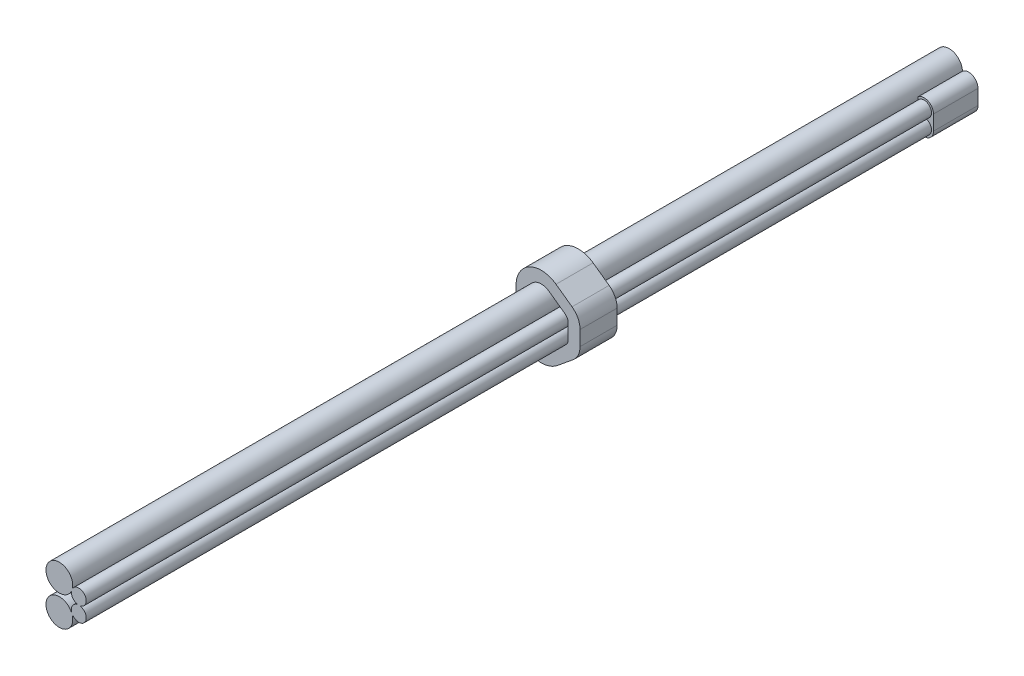
from build123d import *
from build123d.topology import SkipClean

# Parameters (mm, degrees)
BOSS_EXTRUDE1_DEPTH = 2.5
BOSS_EXTRUDE2_DEPTH = 22
BOSS_EXTRUDE3_DEPTH = 3
CUT_EXTRUDE1_DEPTH  = 24.5
BOSS_EXTRUDE4_START = 32.5
BOSS_EXTRUDE4_DEPTH = 32.5
FILLET1_R           = 1.3


with BuildPart() as part:
    # Sketch1 → Boss-Extrude1 (new body)
    with BuildSketch(Plane.XY.offset(27.5)):
        with BuildLine():
            Line((-1.7, 0), (-1.7, -2.01))
            ThreePointArc((-1.7, -2.01), (-0.728058535, -3.546206617), (1.076389141, -3.325821575))
            Line((1.076389141, -3.325821575), (2.613987517, -2.068011074))
            Line((2.613987517, -2.068011074), (2.613987517, 0.214645493))
            Line((2.613987517, 0.214645493), (0.99224156, 1.380382804))
            ThreePointArc((0.99224156, 1.380382804), (-0.775625344, 1.512747608), (-1.7, 0))
        make_face()
        with BuildLine():
            Line((0.679355547, -0.590318593), (0.679355547, -1.419681407))
            ThreePointArc((0.679355547, -1.419681407), (-0.315103164, -1.166963823), (-0.9, -2.01))
            Line((-0.9, -2.01), (-0.9, 0))
            ThreePointArc((-0.9, 0), (-0.315103164, -0.843036177), (0.679355547, -0.590318593))
        make_face(mode=Mode.SUBTRACT)
        with BuildLine():
            Line((1.630572559, -1.838904922), (0.569853074, -2.706611422))
            ThreePointArc((0.569853074, -2.706611422), (0.854555431, -2.292373892), (0.872712282, -1.79006075))
            Line((0.872712282, -1.79006075), (0.923994115, -1.764796557))
            ThreePointArc((0.923994115, -1.764796557), (1.261831892, -1.949170927), (1.630572559, -1.838904922))
        make_face(mode=Mode.SUBTRACT)
        with BuildLine():
            Line((0.525304355, 0.730790896), (1.60582327, -0.045903634))
            ThreePointArc((1.60582327, -0.045903634), (1.206195872, 0.036344151), (0.878343375, -0.206512796))
            Line((0.878343375, -0.206512796), (0.876200076, -0.205605026))
            ThreePointArc((0.876200076, -0.205605026), (0.842771024, 0.315811655), (0.525304355, 0.730790896))
        make_face(mode=Mode.SUBTRACT)
        with BuildLine():
            Line((1.813987517, -0.451898576), (1.813987517, -1.451898576))
            ThreePointArc((1.813987517, -1.451898576), (1.699848532, -1.133918581), (1.409542408, -0.961114242))
            Line((1.409542408, -0.961114242), (1.412543995, -0.942088969))
            ThreePointArc((1.412543995, -0.942088969), (1.700819677, -0.768696431), (1.813987517, -0.451898576))
        make_face(mode=Mode.SUBTRACT)
    extrude(amount=-BOSS_EXTRUDE1_DEPTH)

    # Sketch2 → Boss-Extrude2 (add)
    with BuildSketch(Plane(origin=(0, 0, 25), x_dir=(-1, 0, 0), z_dir=(0, 0, -1))):
        with BuildLine():
            Line((-0.872712282, -1.79006075), (-0.923994115, -1.764796557))
            ThreePointArc((-0.923994115, -1.764796557), (-1.741947592, -1.710452584), (-1.409542408, -0.961114242))
            Line((-1.409542408, -0.961114242), (-1.412543995, -0.942088968))
            ThreePointArc((-1.412543995, -0.942088968), (-1.718555312, -0.158087582), (-0.878343375, -0.206512796))
            Line((-0.878343375, -0.206512796), (-0.876200076, -0.205605026))
            ThreePointArc((-0.876200076, -0.205605026), (0.801211243, 0.40995188), (-0.679355547, -0.590318593))
            Line((-0.679355547, -0.590318593), (-0.679355547, -1.419681407))
            ThreePointArc((-0.679355547, -1.419681407), (0.797824448, -2.426504681), (-0.872712282, -1.79006075))
        make_face()
    extrude(amount=BOSS_EXTRUDE2_DEPTH)

    # Sketch3 → Boss-Extrude3 (add)
    with BuildSketch(Plane(origin=(0, 0, 3), x_dir=(-1, 0, 0), z_dir=(0, 0, -1))):
        with BuildLine():
            Line((-0.679355547, -0.590318593), (-0.679355547, -1.419681407))
            ThreePointArc((-0.679355547, -1.419681407), (0.828144816, -2.362386385), (-0.896420024, -1.929805603))
            ThreePointArc((-0.896420024, -1.929805603), (-1.576433756, -2.029721828), (-1.948619488, -1.451898576))
            Line((-1.948619488, -1.451898576), (-1.948619488, -0.451898576))
            ThreePointArc((-1.948619488, -0.451898576), (-1.578314183, 0.125066892), (-0.8995417, 0.028718114))
            ThreePointArc((-0.8995417, 0.028718114), (0.847956803, 0.301611107), (-0.679355547, -0.590318593))
        make_face()
    extrude(amount=BOSS_EXTRUDE3_DEPTH)

    # Sketch4 → Cut-Extrude1 (cut)
    with BuildSketch(Plane.XY.offset(27.5)):
        with BuildLine():
            Line((0.679355547, -0.590318593), (0.679355547, -1.419681407))
            ThreePointArc((0.679355547, -1.419681407), (0.747780209, -1.50917592), (0.804488538, -1.60651742))
            Line((0.804488538, -1.60651742), (0.833948407, -1.591764415))
            ThreePointArc((0.833948407, -1.591764415), (0.881698314, -1.200649606), (1.197901281, -0.965561259))
            Line((1.197901281, -0.965561259), (1.197901281, -0.938235893))
            ThreePointArc((1.197901281, -0.938235893), (0.900174078, -0.732537913), (0.819207563, -0.379837516))
            Line((0.819207563, -0.379837516), (0.816593613, -0.378384554))
            ThreePointArc((0.816593613, -0.378384554), (0.755443566, -0.489188122), (0.679355547, -0.590318593))
        make_face()
    extrude(amount=-CUT_EXTRUDE1_DEPTH, mode=Mode.SUBTRACT)

    # Sketch5 → Boss-Extrude4 (add)
    with SkipClean():  # the faces are left unmerged after this step: merging them gives an invalid solid
        with BuildSketch(Plane.XY.offset(27.5).offset(BOSS_EXTRUDE4_START)):
            with BuildLine():
                Line((0.923994116, -1.764796557), (0.872712282, -1.79006075))
                ThreePointArc((0.872712282, -1.79006075), (-0.84360695, -2.323571865), (0.804488538, -1.60651742))
                Line((0.804488538, -1.60651742), (0.833948407, -1.591764415))
                ThreePointArc((0.833948407, -1.591764415), (0.881698314, -1.200649606), (1.197901281, -0.965561259))
                Line((1.197901281, -0.965561259), (1.197901281, -0.938235893))
                ThreePointArc((1.197901281, -0.938235893), (0.900174078, -0.732537913), (0.819207563, -0.379837516))
                Line((0.819207563, -0.379837516), (0.816593613, -0.378384554))
                ThreePointArc((0.816593613, -0.378384554), (-0.850794223, 0.293511823), (0.876200076, -0.205605026))
                Line((0.876200076, -0.205605026), (0.878343375, -0.206512796))
                ThreePointArc((0.878343375, -0.206512796), (1.718555312, -0.158087582), (1.412543995, -0.942088968))
                Line((1.412543995, -0.942088968), (1.409542408, -0.961114242))
                ThreePointArc((1.409542408, -0.961114242), (1.741947592, -1.710452584), (0.923994116, -1.764796557))
            make_face()
        extrude(amount=-BOSS_EXTRUDE4_DEPTH)

    # Fillet1
    fillet1_edges = [part.edges().sort_by_distance(p)[0] for p in [
        (2.613987517, 0.214645493, 26.25),
        (2.613987517, -2.068011074, 26.25),
    ]]
    fillet(fillet1_edges, radius=FILLET1_R)


solid = part.part
